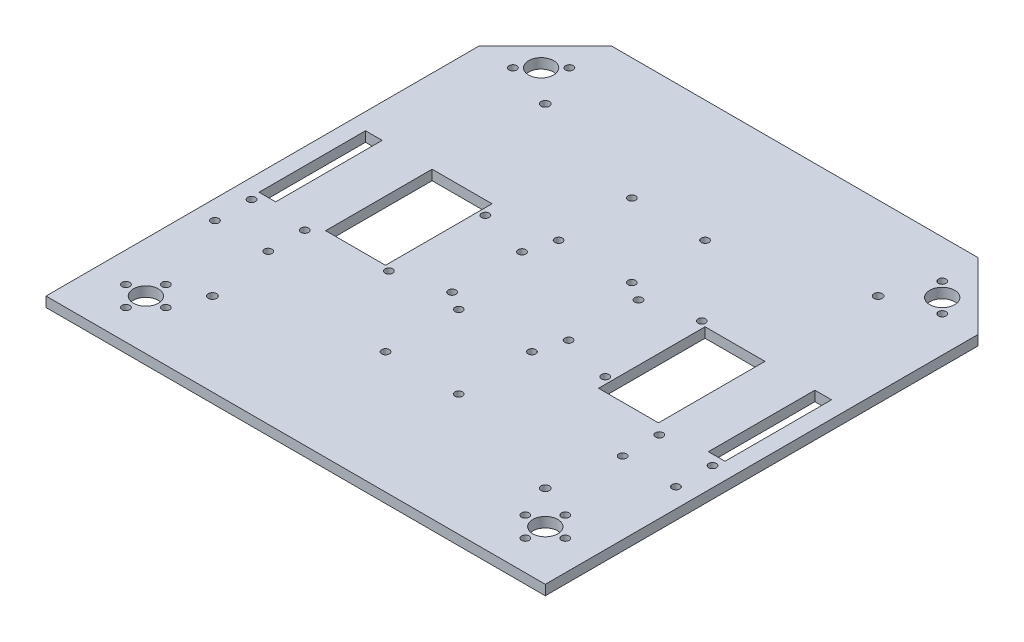
from build123d import *

# Parameters (mm, degrees)
ESQUISSE1_R              = 7.5
ESQUISSE1_R_2            = 2.3
BOSS_EXTRU_1_DEPTH       = 6
ENL_V_MAT_EXTRU_9_DEPTH  = 10.5
ESQUISSE6_R              = 2.3
ENL_V_MAT_EXTRU_10_DEPTH = 50
ENL_V_MAT_EXTRU_11_DEPTH = 50
ESQUISSE9_R              = 2.5
ENL_V_MAT_EXTRU_12_DEPTH = 35
ESQUISSE3_R              = 2.3
ENL_V_MAT_EXTRU_13_DEPTH = 35
ESQUISSE10_R             = 2.3
ENL_V_MAT_EXTRU_14_DEPTH = 10


with BuildPart() as part:
    # Esquisse1 → Boss.-Extru.1 (new body)
    with BuildSketch(Plane(origin=(0, 0, 0), x_dir=(1, 0, 0), z_dir=(0, 1, 0))):
        Polygon((-150, 0), (-150, 260), (-110, 300), (110, 300), (150, 260), (150, 0), align=None)
        with Locations((-120, 30)):
            Circle(ESQUISSE1_R, mode=Mode.SUBTRACT)
        with Locations((-120, 267.5)):
            Circle(ESQUISSE1_R, mode=Mode.SUBTRACT)
        with Locations((120, 268.5)):
            Circle(ESQUISSE1_R, mode=Mode.SUBTRACT)
        with Locations((-111.514718626, 275.985281374)):
            Circle(ESQUISSE1_R_2, mode=Mode.SUBTRACT)
        with Locations((-128.485281374, 259.014718626)):
            Circle(ESQUISSE1_R_2, mode=Mode.SUBTRACT)
        with Locations((111.514718626, 276.985281374)):
            Circle(ESQUISSE1_R_2, mode=Mode.SUBTRACT)
        with Locations((128.485281374, 260.014718626)):
            Circle(ESQUISSE1_R_2, mode=Mode.SUBTRACT)
        with Locations((120, 30)):
            Circle(ESQUISSE1_R, mode=Mode.SUBTRACT)
        with Locations((120, 42)):
            Circle(ESQUISSE1_R_2, mode=Mode.SUBTRACT)
        with Locations((-120, 42)):
            Circle(ESQUISSE1_R_2, mode=Mode.SUBTRACT)
        with Locations((-120, 18)):
            Circle(ESQUISSE1_R_2, mode=Mode.SUBTRACT)
        with Locations((-132, 30)):
            Circle(ESQUISSE1_R_2, mode=Mode.SUBTRACT)
        with Locations((-108, 30)):
            Circle(ESQUISSE1_R_2, mode=Mode.SUBTRACT)
        with Locations((108, 30)):
            Circle(ESQUISSE1_R_2, mode=Mode.SUBTRACT)
        with Locations((132, 30)):
            Circle(ESQUISSE1_R_2, mode=Mode.SUBTRACT)
        with Locations((120, 18)):
            Circle(ESQUISSE1_R_2, mode=Mode.SUBTRACT)
    extrude(amount=BOSS_EXTRU_1_DEPTH)

    # Esquisse7 → Enlèv. mat.-Extru.9 (cut)
    with BuildSketch(Plane(origin=(0, 6, 0), x_dir=(1, 0, 0), z_dir=(0, 1, 0))):
        Polygon((-130, 150), (-130, 182), (-140, 182), (-140, 118), (-130, 118), align=None)
    enl_v_mat_extru_9 = extrude(amount=-ENL_V_MAT_EXTRU_9_DEPTH, mode=Mode.SUBTRACT)

    # Esquisse6 → Enlèv. mat.-Extru.10 (cut)
    with BuildSketch(Plane(origin=(0, 6, 0), x_dir=(1, 0, 0), z_dir=(0, 1, 0))):
        with Locations((-138.5, 90)):
            Circle(ESQUISSE6_R)
        with Locations((-138.5, 112)):
            Circle(ESQUISSE6_R)
        with Locations((-106.5, 112)):
            Circle(ESQUISSE6_R)
        with Locations((-106.5, 90)):
            Circle(ESQUISSE6_R)
    enl_v_mat_extru_10 = extrude(amount=-ENL_V_MAT_EXTRU_10_DEPTH, mode=Mode.SUBTRACT)

    # Esquisse4 → Enlèv. mat.-Extru.11 (cut)
    with BuildSketch(Plane(origin=(0, 6, 0), x_dir=(1, 0, 0), z_dir=(0, 1, 0))):
        Polygon((-100, 150), (-100, 182), (-64, 182), (-64, 118), (-100, 118), align=None)
    enl_v_mat_extru_11 = extrude(amount=-ENL_V_MAT_EXTRU_11_DEPTH, mode=Mode.SUBTRACT)

    # Symétrie1: Enlèv. mat.-Extru.9 across plane
    add(enl_v_mat_extru_9.mirror(Plane(origin=(0, 0, 0), x_dir=(0, 0, 1), z_dir=(1, 0, 0))), mode=Mode.SUBTRACT)

    # Symétrie2: Enlèv. mat.-Extru.11 across plane
    add(enl_v_mat_extru_11.mirror(Plane(origin=(0, 0, 0), x_dir=(0, 0, 1), z_dir=(1, 0, 0))), mode=Mode.SUBTRACT)

    # Symétrie3: Enlèv. mat.-Extru.10 across plane
    add(enl_v_mat_extru_10.mirror(Plane(origin=(0, 0, 0), x_dir=(0, 0, 1), z_dir=(1, 0, 0))), mode=Mode.SUBTRACT)

    # Esquisse9 → Enlèv. mat.-Extru.12 (cut)
    with BuildSketch(Plane(origin=(0, 6, 0), x_dir=(1, 0, 0), z_dir=(0, 1, 0))):
        with Locations((-100, 50)):
            Circle(ESQUISSE9_R)
        with Locations((100, 50)):
            Circle(ESQUISSE9_R)
        with Locations((100, 250)):
            Circle(ESQUISSE9_R)
        with Locations((-100, 250)):
            Circle(ESQUISSE9_R)
    extrude(amount=-ENL_V_MAT_EXTRU_12_DEPTH, mode=Mode.SUBTRACT)

    # Esquisse3 → Enlèv. mat.-Extru.13 (cut)
    with BuildSketch(Plane(origin=(0, 6, 0), x_dir=(1, 0, 0), z_dir=(0, 1, 0))):
        with Locations((-60, 174)):
            Circle(ESQUISSE3_R)
        with Locations((-60, 116)):
            Circle(ESQUISSE3_R)
        with Locations((-30, 166)):
            Circle(ESQUISSE3_R)
        with Locations((-30, 124)):
            Circle(ESQUISSE3_R)
        with Locations((60, 184)):
            Circle(ESQUISSE3_R)
        with Locations((30, 176)):
            Circle(ESQUISSE3_R)
        with Locations((30, 134)):
            Circle(ESQUISSE3_R)
        with Locations((60, 126)):
            Circle(ESQUISSE3_R)
    extrude(amount=-ENL_V_MAT_EXTRU_13_DEPTH, mode=Mode.SUBTRACT)

    # Esquisse10 → Enlèv. mat.-Extru.14 (cut)
    with BuildSketch(Plane(origin=(0, 6, 0), x_dir=(1, 0, 0), z_dir=(0, 1, 0))):
        with Locations((-19, 73)):
            Circle(ESQUISSE10_R)
        with Locations((-19, 117)):
            Circle(ESQUISSE10_R)
        with Locations((25, 73)):
            Circle(ESQUISSE10_R)
        with Locations((25, 117)):
            Circle(ESQUISSE10_R)
        with Locations((-24.999750468, 227)):
            Circle(ESQUISSE10_R)
        with Locations((-24.999750468, 183)):
            Circle(ESQUISSE10_R)
        with Locations((19, 183)):
            Circle(ESQUISSE10_R)
        with Locations((19, 227)):
            Circle(ESQUISSE10_R)
    extrude(amount=-ENL_V_MAT_EXTRU_14_DEPTH, mode=Mode.SUBTRACT)


solid = part.part
